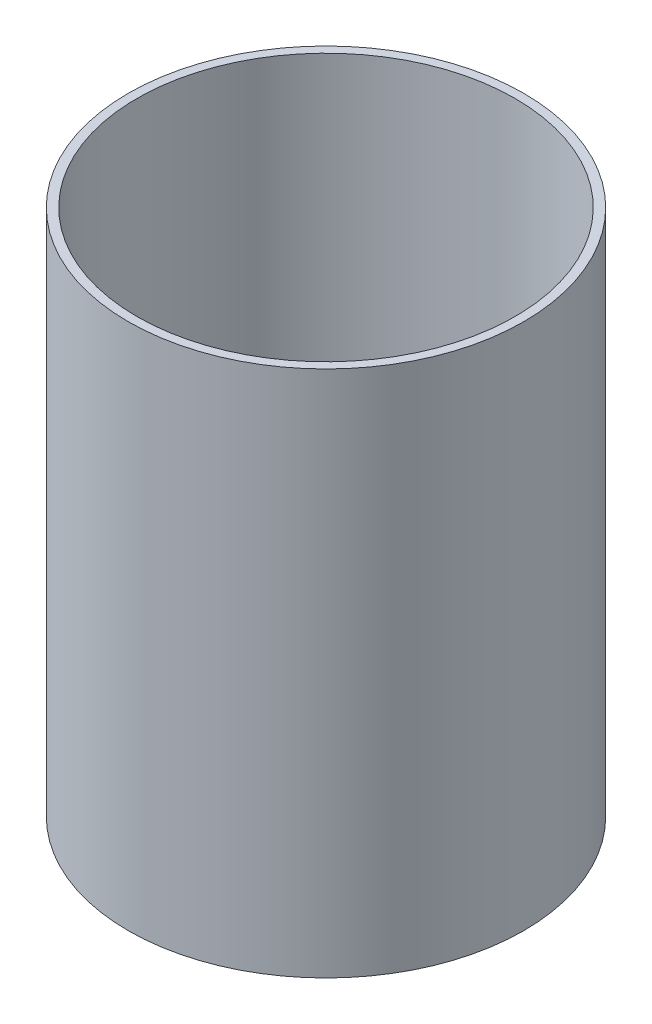
from build123d import *

# Parameters (mm, degrees)
SKETCH1_R        = 45
JAR_BODY_DEPTH   = 120
JAR_INSIDE_START = 120
SKETCH2_R        = 43
JAR_INSIDE_DEPTH = 117


with BuildPart() as part:
    # Sketch1 → Jar_Body (new body)
    with BuildSketch(Plane(origin=(0, 0, 0), x_dir=(1, 0, 0), z_dir=(0, 1, 0))):
        with Locations(Location((0, 0, 0), (0, 0, 270))):
            Circle(SKETCH1_R)
    extrude(amount=JAR_BODY_DEPTH)

    # Sketch2 → Jar_Inside (cut)
    with BuildSketch(Plane(origin=(0, 0, 0), x_dir=(1, 0, 0), z_dir=(0, 1, 0)).offset(JAR_INSIDE_START)):
        with Locations(Location((0, 0, 0), (0, 0, 270))):
            Circle(SKETCH2_R)
    extrude(amount=-JAR_INSIDE_DEPTH, mode=Mode.SUBTRACT)


solid = part.part
